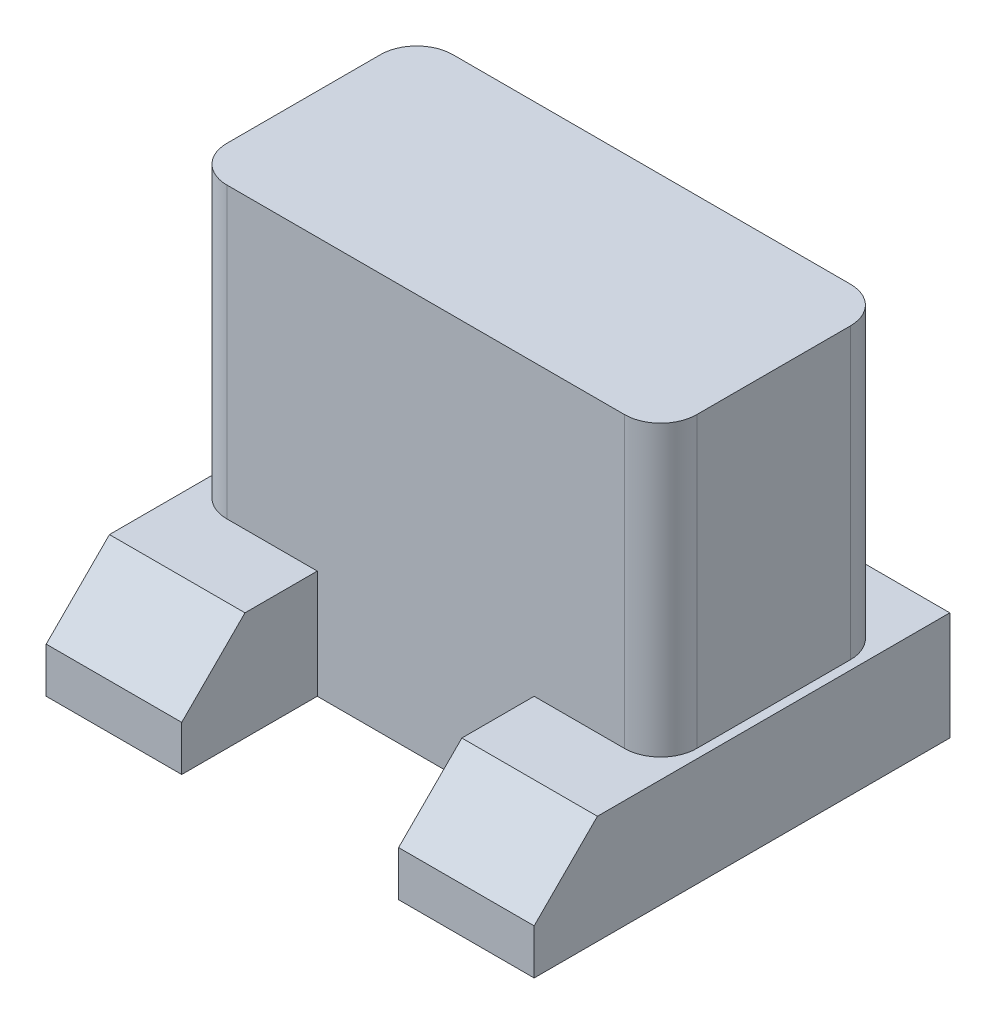
from build123d import *

# Parameters (mm, degrees)
EXTRUDE_3_DEPTH      = 3.2
EXTRUDE_3_DEPTH_BACK = 1.2
SKETCH_2_W           = 5.4
SKETCH_2_H           = 2.5
EXTRUDE_4_DEPTH      = 1.2
SKETCH_5_W           = 4
SKETCH_5_H           = 1.5
EXTRUDE_7_DEPTH      = 0.5
SKETCH_6_W           = 1.5
SKETCH_6_H           = 1.2
EXTRUDE_8_DEPTH      = 0.6
SKETCH_7_W           = 1.5
SKETCH_7_H           = 1.2
EXTRUDE_9_DEPTH      = 1.5
CHAMFER_2_SIZE       = 0.7


with BuildPart() as part:
    # 草图1 → 凸台-拉伸3 (new, two sides: drawn at the far end of the back side and taken through both)
    with BuildSketch(Plane(origin=(0, 0, 0), x_dir=(1, 0, 0), z_dir=(0, 1, 0)).offset(-EXTRUDE_3_DEPTH_BACK)):
        with BuildLine():
            Line((-2.6, 0.85), (-2.6, -0.85))
            ThreePointArc((-2.6, -0.85), (-2.482842712, -1.132842712), (-2.2, -1.25))
            Line((-2.2, -1.25), (2.2, -1.25))
            ThreePointArc((2.2, -1.25), (2.482842712, -1.132842712), (2.6, -0.85))
            Line((2.6, -0.85), (2.6, 0.85))
            ThreePointArc((2.6, 0.85), (2.482842712, 1.132842712), (2.2, 1.25))
            Line((2.2, 1.25), (-2.2, 1.25))
            ThreePointArc((-2.2, 1.25), (-2.482842712, 1.132842712), (-2.6, 0.85))
        make_face()
    extrude(amount=EXTRUDE_3_DEPTH + EXTRUDE_3_DEPTH_BACK)

    # 草图2 → 凸台-拉伸4 (add)
    with BuildSketch(Plane(origin=(0, 0, 0), x_dir=(1, 0, 0), z_dir=(0, 1, 0))):
        Rectangle(SKETCH_2_W, SKETCH_2_H)
    extrude(amount=-EXTRUDE_4_DEPTH)

    # 草图5 → 凸台-拉伸7 (add)
    with BuildSketch(Plane(origin=(0, -1.2, 0), x_dir=(-1, 0, 0), z_dir=(0, -1, 0))):
        with Locations((0, 0.15)):
            Rectangle(SKETCH_5_W, SKETCH_5_H)
    extrude(amount=EXTRUDE_7_DEPTH)

    # 草图6 → 凸台-拉伸8 (add)
    with BuildSketch(Plane(origin=(0, 0, -1.25), x_dir=(-1, 0, 0), z_dir=(0, 0, -1))):
        with Locations((1.95, -0.6)):
            Rectangle(SKETCH_6_W, SKETCH_6_H)
        with Locations((-1.95, -0.6)):
            Rectangle(SKETCH_6_W, SKETCH_6_H)
    extrude(amount=EXTRUDE_8_DEPTH)

    # 草图7 → 凸台-拉伸9 (add)
    with BuildSketch(Plane.XY.offset(1.25)):
        with Locations((1.95, -0.6)):
            Rectangle(SKETCH_7_W, SKETCH_7_H)
        with Locations((-1.95, -0.6)):
            Rectangle(SKETCH_7_W, SKETCH_7_H)
    extrude(amount=EXTRUDE_9_DEPTH)

    # 倒角2
    chamfer_2_edges = [part.edges().sort_by_distance(p)[0] for p in [
        (1.95, 0, 2.75),
        (-1.95, 0, 2.75),
    ]]
    chamfer(chamfer_2_edges, length=CHAMFER_2_SIZE)


solid = part.part
